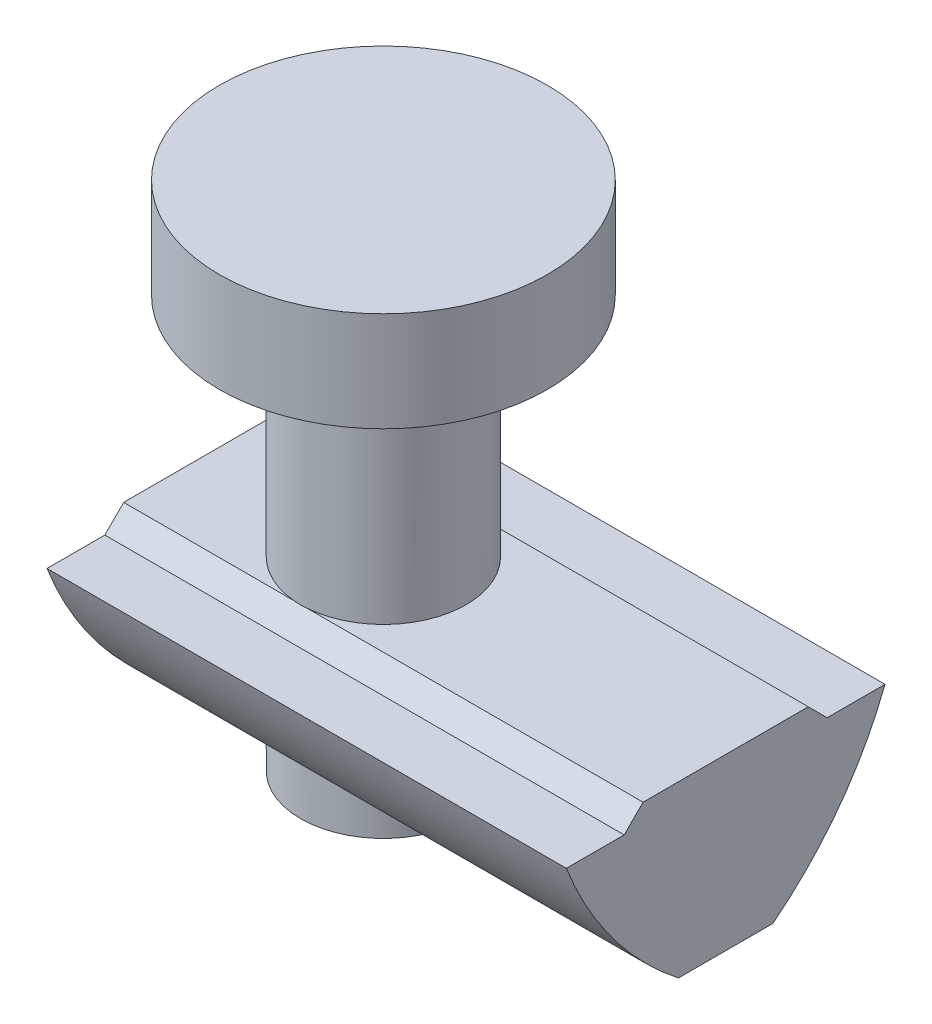
from build123d import *

# Parameters (mm, degrees)
SKETCH1_R                = 6.9469
BOSS_EXTRUDE1_DEPTH      = 4.22
SKETCH2_R                = 3.51
BOSS_EXTRUDE2_DEPTH      = 17.46
BOSS_EXTRUDE3_DEPTH      = 14.5
BOSS_EXTRUDE3_DEPTH_BACK = 7.5


with BuildPart() as part:
    # Sketch1 → Boss-Extrude1 (new body)
    with BuildSketch(Plane(origin=(0, 0, 0), x_dir=(1, 0, 0), z_dir=(0, 1, 0))):
        with Locations(Location((0, 0, 0), (0, 0, 270))):
            Circle(SKETCH1_R)
    extrude(amount=BOSS_EXTRUDE1_DEPTH)

    # Sketch2 → Boss-Extrude2 (add)
    with BuildSketch(Plane(origin=(0, 0, 0), x_dir=(-1, 0, 0), z_dir=(0, -1, 0))):
        with Locations(Location((0, 0, 0), (0, 0, 90))):
            Circle(SKETCH2_R)
    extrude(amount=BOSS_EXTRUDE2_DEPTH)

    # Sketch3 → Boss-Extrude3 (add, two sides: drawn at the far end of the back side and taken through both)
    with BuildSketch(Plane(origin=(0, 0, 0), x_dir=(0, 0, -1), z_dir=(1, 0, 0)).offset(-BOSS_EXTRUDE3_DEPTH_BACK)):
        with BuildLine():
            Line((-6.249999984, -10.41), (-6.75, -10.41))
            ThreePointArc((-6.75, -10.41), (-4.807849454, -13.931255454), (-2, -16.81))
            Line((-2, -16.81), (2, -16.81))
            ThreePointArc((2, -16.81), (4.807849454, -13.931255454), (6.75, -10.41))
            Line((6.75, -10.41), (6.249999984, -10.41))
            Line((6.249999984, -10.41), (4.3, -10.41))
            Line((4.3, -10.41), (3.5, -9.61))
            Line((3.5, -9.61), (-3.5, -9.61))
            Line((-3.5, -9.61), (-4.3, -10.41))
            Line((-4.3, -10.41), (-6.249999984, -10.41))
        make_face()
    extrude(amount=BOSS_EXTRUDE3_DEPTH + BOSS_EXTRUDE3_DEPTH_BACK)


solid = part.part
